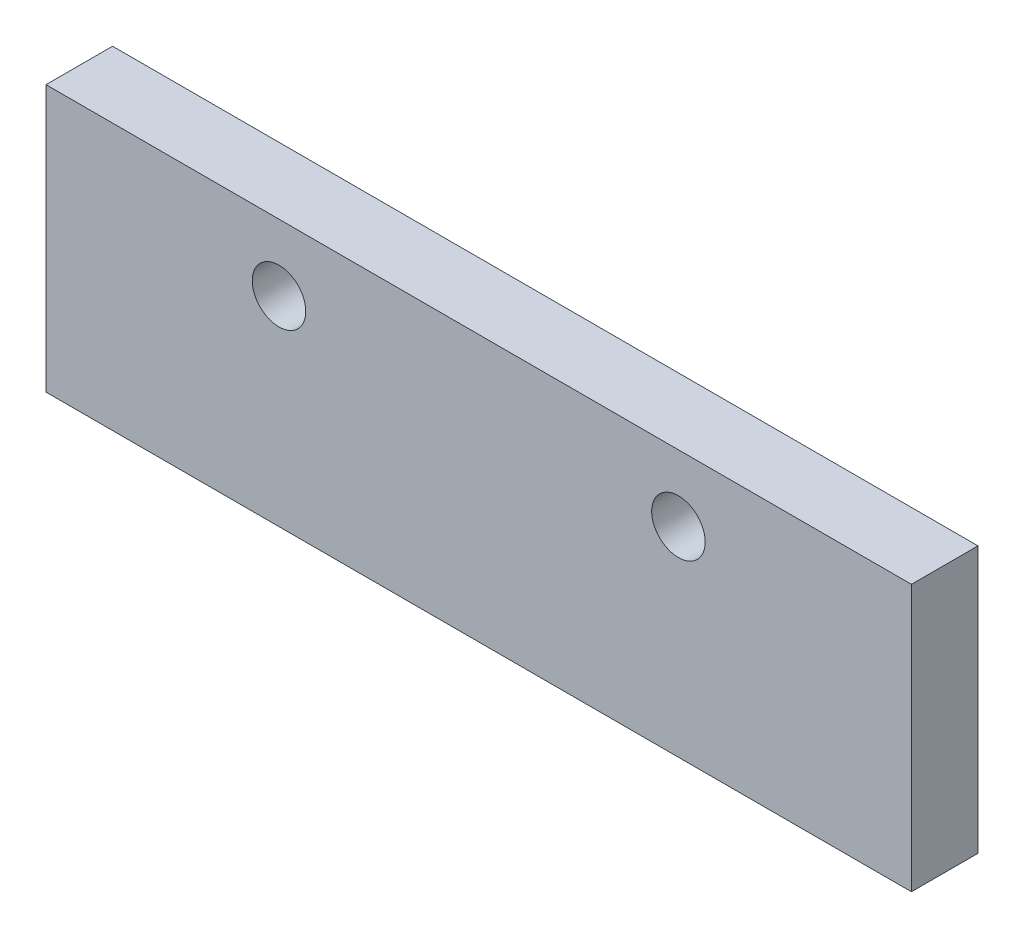
from build123d import *

# Parameters (mm, degrees)
SKETCH1_W               = 82.55
SKETCH1_H               = 25.4
BOSS_EXTRUDE1_DEPTH     = 6.35
F_1_4_20_TAPPED_HOLE1_D = 5.1054


with BuildPart() as part:
    # Sketch1 → Boss-Extrude1 (new body)
    with BuildSketch(Plane.XY):
        with Locations((41.275, 12.7)):
            Rectangle(SKETCH1_W, SKETCH1_H)
    extrude(amount=-BOSS_EXTRUDE1_DEPTH)

    # 1/4-20 Tapped Hole1 (through all)
    with Locations(Plane.XY):
        with Locations((22.225, 19.05), (60.325, 19.05)):
            Hole(F_1_4_20_TAPPED_HOLE1_D / 2)


solid = part.part
